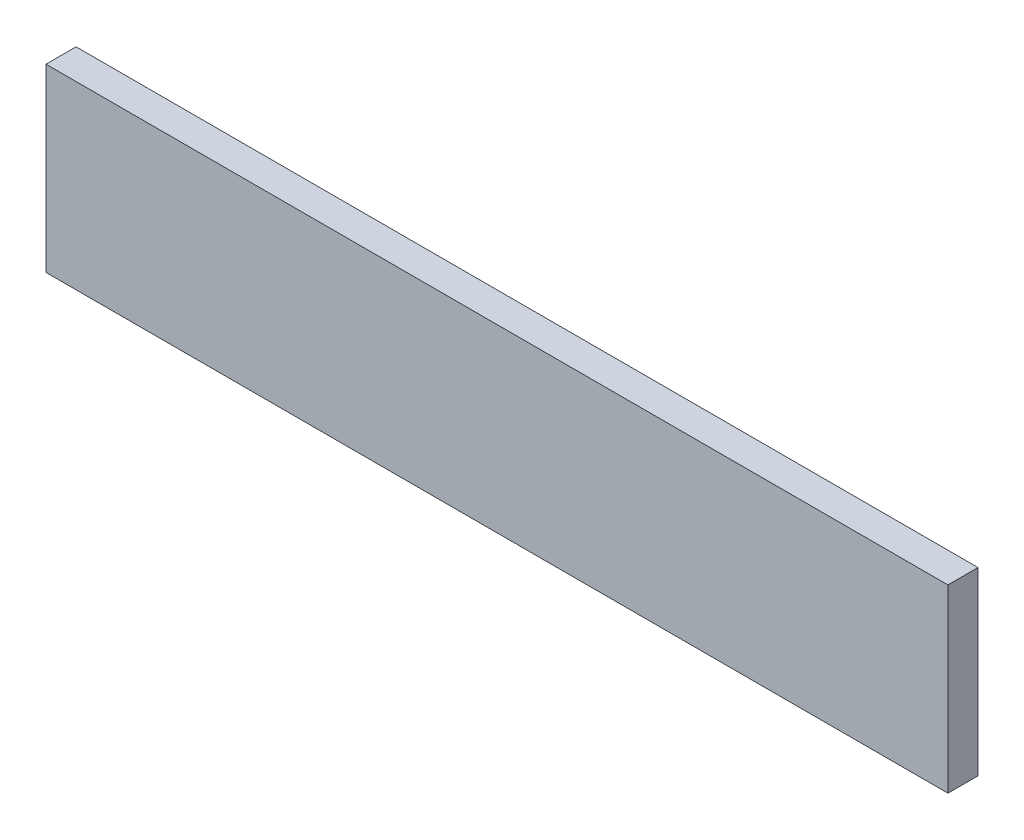
from build123d import *

# Parameters (mm, degrees)
SKETCH_1_W        = 300
SKETCH_1_H        = 60
EXTRUDE_335_DEPTH = 10


with BuildPart() as part:
    # Эскиз1 → Extrude 335 (new body)
    with BuildSketch(Plane.XY):
        with Locations((150, 30)):
            Rectangle(SKETCH_1_W, SKETCH_1_H)
    extrude(amount=EXTRUDE_335_DEPTH)


solid = part.part
